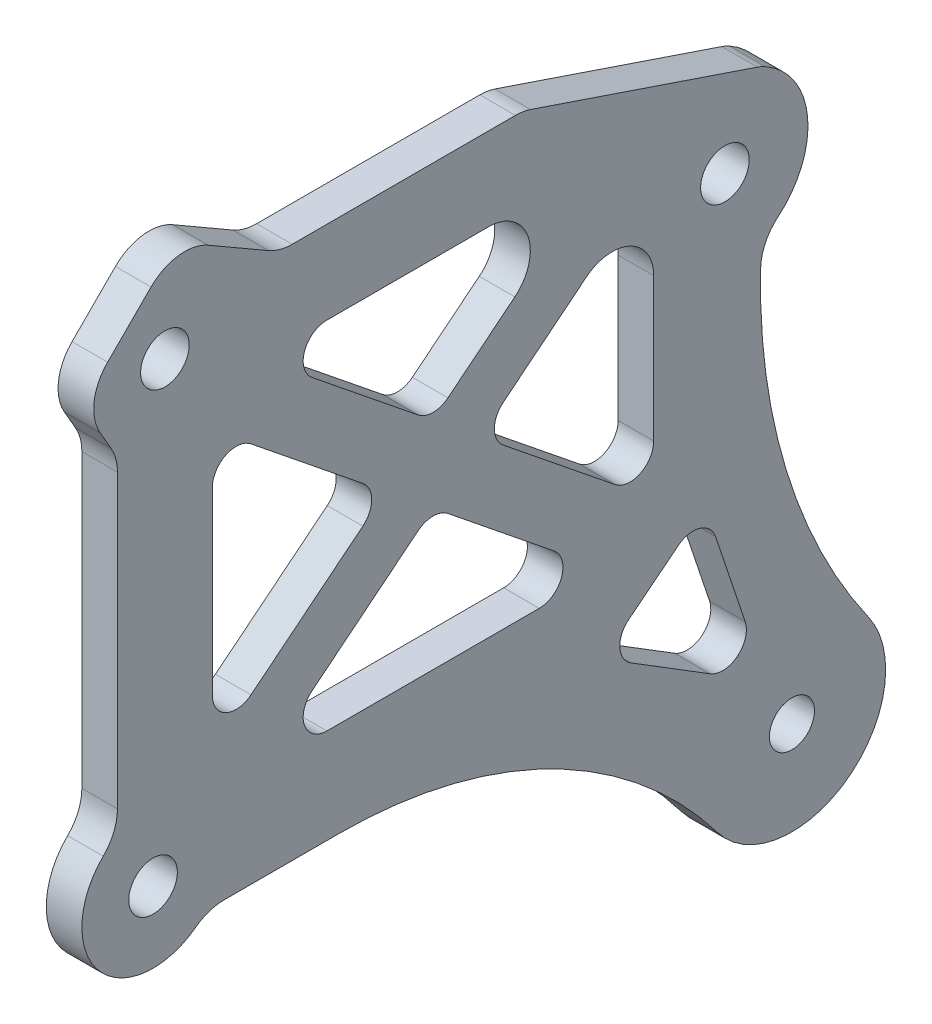
from build123d import *

# Parameters (mm, degrees)
SKETCH_1_R          = 1.9
SKETCH_1_R_2        = 2.05
EXTRUDE_1_DEPTH     = 3
EXTRUDE_2_DEPTH     = 3
CUT_EXTRUDE_1_DEPTH = 10
FILLET_1_R          = 2
FILLET_2_R          = 4
FILLET_3_R          = 3.5
CUT_EXTRUDE_2_DEPTH = 10
FILLET_4_R          = 2


with BuildPart() as part:
    # 草图1 → 凸台-拉伸1 (new body)
    with BuildSketch(Plane(origin=(0, 0, 0), x_dir=(0, 0, -1), z_dir=(1, 0, 0))):
        with BuildLine():
            Line((-3, 40.986839826), (-3, 5.196152423))
            ThreePointArc((-3, 5.196152423), (-4.656619043, -3.783635697), (4.472135955, -4))
            Line((4.472135955, -4), (15.668888745, -4))
            ThreePointArc((15.668888745, -4), (33.469294357, -8.178978797), (47.550324088, -19.842721997))
            ThreePointArc((47.550324088, -19.842721997), (58.506158977, -21.45142262), (60.307864912, -10.525669029))
            ThreePointArc((60.307864912, -10.525669029), (53.0476279, 4.779832589), (51.314694229, 21.631134085))
            ThreePointArc((51.314694229, 21.631134085), (55.199709707, 27.963749659), (51.2, 34.22455532))
            Line((51.2, 34.22455532), (51.2, 40.986839826))
            Line((51.2, 40.986839826), (-3, 40.986839826))
        make_face()
        with Locations((53.846907568, -15.071659592)):
            Circle(SKETCH_1_R, mode=Mode.SUBTRACT)
        Circle(SKETCH_1_R_2, mode=Mode.SUBTRACT)
        Polygon((5, 7.211107417), (5, 30.775732409), (19.616479342, 18.993419913), align=None, mode=Mode.SUBTRACT)
        Polygon((38.216479342, 4), (8.983520658, 4), (23.6, 15.782312496), align=None, mode=Mode.SUBTRACT)
        with Locations((1, 37.986839826)):
            Circle(SKETCH_1_R_2, mode=Mode.SUBTRACT)
        Polygon((8.983520658, 33.986839826), (38.216479342, 33.986839826), (23.6, 22.204527331), align=None, mode=Mode.SUBTRACT)
        Polygon((27.583520658, 18.993419913), (42.2, 30.775732409), (42.2, 7.211107417), align=None, mode=Mode.SUBTRACT)
        with Locations((48.2, 27.9)):
            Circle(SKETCH_1_R_2, mode=Mode.SUBTRACT)
    extrude(amount=EXTRUDE_1_DEPTH)

    # 草图2 → 凸台-拉伸2 (add)
    with BuildSketch(Plane(origin=(3, 0, 0), x_dir=(0, 0, -1), z_dir=(1, 0, 0))):
        Polygon((10.660254038, 40.986839826), (2, 45.986839826), (-3, 40.986839826), align=None)
        Polygon((-3, 32.790687404), (-3, 40.986839826), (-6, 37.986839826), align=None)
    extrude(amount=-EXTRUDE_2_DEPTH)

    # 草图3 → 切除-拉伸1 (cut)
    with BuildSketch(Plane(origin=(3, 0, 0), x_dir=(0, 0, -1), z_dir=(1, 0, 0))):
        Polygon((51.2, 34.22455532), (31.2, 40.986839826), (51.2, 40.986839826), align=None)
    extrude(amount=-CUT_EXTRUDE_1_DEPTH, mode=Mode.SUBTRACT)

    # 圆角1
    fillet_1_edges = [part.edges().sort_by_distance(p)[0] for p in [
        (1.5, 22.204527331, -23.6),
        (1.5, 33.986839826, -8.983520658),
        (1.5, 30.775732409, -5),
        (1.5, 7.211107417, -5),
        (1.5, 18.993419913, -19.616479342),
        (1.5, 7.211107417, -42.2),
        (1.5, 18.993419913, -27.583520658),
        (1.5, 4, -8.983520658),
        (1.5, 4, -38.216479342),
        (1.5, 15.782312496, -23.6),
    ]]
    fillet(fillet_1_edges, radius=FILLET_1_R)

    # 圆角2
    fillet_2_edges = [part.edges().sort_by_distance(p)[0] for p in [
        (1.5, -4, -4.472135955),
        (1.5, 5.196152423, 3),
        (1.5, 34.22455532, -51.2),
        (1.5, 21.631134085, -51.314694229),
        (1.5, 45.986839826, -2),
        (1.5, 40.986839826, -10.660254038),
        (1.5, 37.986839826, 6),
        (1.5, 32.790687404, 3),
        (1.5, 40.986839826, -31.2),
    ]]
    fillet(fillet_2_edges, radius=FILLET_2_R)

    # 圆角3
    fillet_3_edges = [part.edges().sort_by_distance(p)[0] for p in [
        (1.5, 33.986839826, -38.216479342),
        (1.5, 30.775732409, -42.2),
    ]]
    fillet(fillet_3_edges, radius=FILLET_3_R)

    # 草图4 → 切除-拉伸2 (cut)
    with BuildSketch(Plane(origin=(3, 0, 0), x_dir=(0, 0, -1), z_dir=(1, 0, 0))):
        Polygon((37.863150267, -2.349540483), (46.512425203, 4.497802174), (51.661041238, -10.892084105), align=None)
    extrude(amount=-CUT_EXTRUDE_2_DEPTH, mode=Mode.SUBTRACT)

    # 圆角4
    fillet_4_edges = [part.edges().sort_by_distance(p)[0] for p in [
        (1.5, -10.892084105, -51.661041238),
        (1.5, -2.349540483, -37.863150267),
        (1.5, 4.497802174, -46.512425203),
    ]]
    fillet(fillet_4_edges, radius=FILLET_4_R)


solid = part.part
